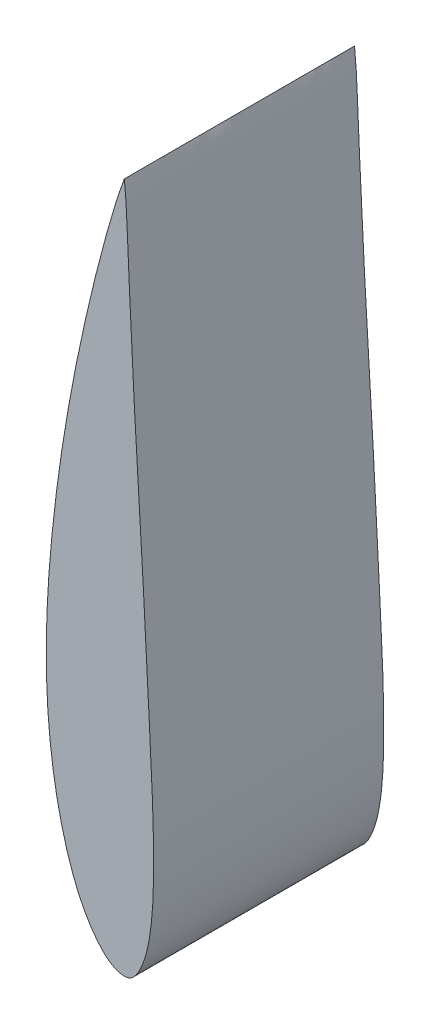
from build123d import *

# Parameters (mm, degrees)
AUFSATZ_LINEAR_AUSTRAGEN1_DEPTH = 10


with BuildPart() as part:
    # Skizze2 → Aufsatz-Linear austragen1 (new body)
    with BuildSketch(Plane(origin=(0, 0, 0), x_dir=(0, 1, 0), z_dir=(0, 0, 1))):
        with BuildLine():
            add(Edge.make_bspline(
                [(28.126156579, -15.466366783), (28.126783161, -15.463868444), (28.056380529, -15.444910484), (27.986905338, -15.413236123), (27.812394633, -15.35350765), (27.596506869, -15.276656887), (27.309824824, -15.179801364), (26.965393898, -15.069585578), (26.560433586, -14.946199643), (26.098112045, -14.812299351), (25.580322297, -14.667292733), (25.009407694, -14.512202876), (24.3875504, -14.349205575), (23.717360939, -14.180236429), (23.00178851, -14.007212275), (22.24406035, -13.831126746), (21.447267488, -13.653483137), (20.614811452, -13.476143671), (19.750253284, -13.301451936), (18.857287354, -13.132091007), (17.939902089, -12.969068706), (17.001837069, -12.814973089), (16.047097043, -12.670921022), (15.079846959, -12.538592502), (14.104159931, -12.41957946), (13.124457519, -12.314237254), (12.14470476, -12.225222813), (11.169046452, -12.154003123), (10.201749685, -12.102750529), (9.24688039, -12.073919498), (8.308659564, -12.069631446), (7.390992419, -12.089867572), (6.497803871, -12.136112341), (5.632931915, -12.207830457), (4.800190768, -12.303823154), (4.003147234, -12.422242802), (3.245048161, -12.561174397), (2.529374893, -12.72067845), (1.85892033, -12.896997961), (1.236230322, -13.08739951), (0.663839708, -13.29248209), (0.145201493, -13.514596278), (-0.317791233, -13.750228517), (-0.722358559, -13.994899958), (-1.069709694, -14.239312293), (-1.357177106, -14.483662603), (-1.586567623, -14.728567912), (-1.749519132, -14.98052524), (-1.8468935, -15.227521219), (-1.884682613, -15.456213559), (-1.855266048, -15.662356796), (-1.746101747, -15.835225102), (-1.576016844, -15.981407196), (-1.350439923, -16.12168783), (-1.062443058, -16.251174351), (-0.71628245, -16.373945674), (-0.310533014, -16.482482663), (0.152972685, -16.570579563), (0.671569463, -16.639031), (1.243064912, -16.689768086), (1.865291942, -16.722689844), (2.535656872, -16.739288333), (3.251196041, -16.741067356), (4.008866848, -16.73121974), (4.805597407, -16.709510761), (5.637944913, -16.676956599), (6.502368217, -16.637172579), (7.395078168, -16.59257426), (8.312316204, -16.545846422), (9.250185649, -16.498146445), (10.204758448, -16.449215827), (11.171834074, -16.398838676), (12.147297539, -16.346536965), (13.126862773, -16.2924832), (14.10642001, -16.236602633), (15.081852135, -16.17902888), (16.048902418, -16.12109038), (17.003415853, -16.062859012), (17.941228427, -16.006083072), (18.858502146, -15.952806957), (19.751234612, -15.902068597), (20.615716767, -15.855682807), (21.448094342, -15.812819048), (22.244772916, -15.773266288), (23.002356222, -15.736813996), (23.717722775, -15.702891592), (24.387800282, -15.672105416), (25.009584686, -15.644387899), (25.580450541, -15.61948693), (26.098107484, -15.598259956), (26.560135874, -15.578097785), (26.965048476, -15.558166263), (27.309459022, -15.537233346), (27.596184259, -15.515901413), (27.812716472, -15.495903363), (27.985802511, -15.48219432), (28.058189594, -15.470167423), (28.125564779, -15.468726435), (28.126156579, -15.466366783)],
                knots=[0, 0, 0, 0, 0.000551748, 0.002206993, 0.004953318, 0.008768597, 0.01362371, 0.019491754, 0.026331376, 0.034118238, 0.042814764, 0.052380389, 0.062780118, 0.073959334, 0.085864938, 0.098446304, 0.111647061, 0.125414729, 0.139681019, 0.154378272, 0.169446878, 0.184821178, 0.200432901, 0.21622378, 0.232116859, 0.248051216, 0.263959621, 0.279776549, 0.295442409, 0.310884918, 0.326054012, 0.340892172, 0.355348528, 0.369377925, 0.382929883, 0.395952713, 0.408409585, 0.420261405, 0.431467241, 0.441987752, 0.451798802, 0.46090969, 0.469303541, 0.476945896, 0.483797691, 0.489858128, 0.495197566, 0.499996833, 0.504303705, 0.507974056, 0.511122506, 0.514149356, 0.517650444, 0.521912415, 0.526982255, 0.532915788, 0.539692296, 0.547308645, 0.555757426, 0.565025083, 0.575098193, 0.585939785, 0.597509159, 0.609762381, 0.622648894, 0.636121865, 0.650117759, 0.664572179, 0.679425296, 0.69461325, 0.710068303, 0.725732643, 0.741529127, 0.757394896, 0.773262272, 0.789063315, 0.80473434, 0.820197409, 0.835393048, 0.850252142, 0.864711864, 0.878713432, 0.892194297, 0.90509186, 0.917358005, 0.928939748, 0.939788483, 0.949855831, 0.959093409, 0.967472192, 0.974954677, 0.981503133, 0.987099409, 0.991709921, 0.995322896, 0.997916482, 0.99947888, 1, 1, 1, 1], degree=3))
        make_face()
    extrude(amount=AUFSATZ_LINEAR_AUSTRAGEN1_DEPTH)


solid = part.part
